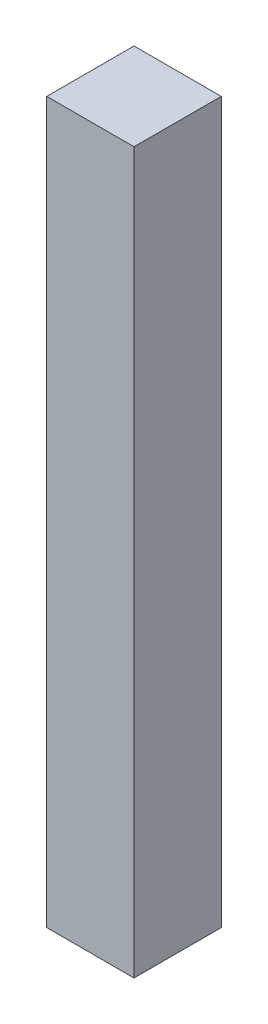
from build123d import *

# Parameters (mm, degrees)
SKETCH1_W           = 80
SKETCH1_H           = 80
BOSS_EXTRUDE1_DEPTH = 660
SKETCH2_R           = 9
CUT_EXTRUDE1_DEPTH  = 590


with BuildPart() as part:
    # Sketch1 → Boss-Extrude1 (new body)
    with BuildSketch(Plane(origin=(0, 0, 0), x_dir=(1, 0, 0), z_dir=(0, 1, 0))):
        Rectangle(SKETCH1_W, SKETCH1_H)
    extrude(amount=BOSS_EXTRUDE1_DEPTH)

    # Sketch2 → Cut-Extrude1 (cut)
    with BuildSketch(Plane.XZ):
        with Locations(Location((0, 0, 0), (0, 0, 270))):
            Circle(SKETCH2_R)
    extrude(amount=-CUT_EXTRUDE1_DEPTH, mode=Mode.SUBTRACT)


solid = part.part
